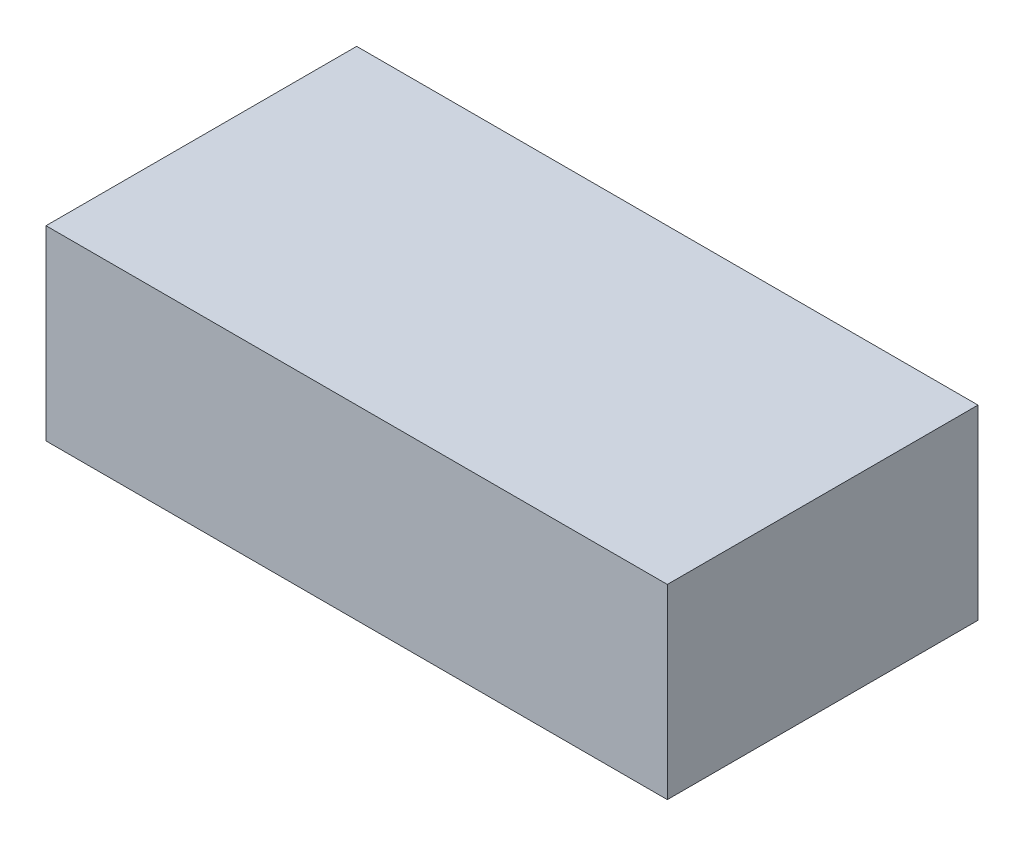
from build123d import *

# Parameters (mm, degrees)
SKETCH1_W           = 20
SKETCH1_H           = 10
BOSS_EXTRUDE1_DEPTH = 6


with BuildPart() as part:
    # Sketch1 → Boss-Extrude1 (new body)
    with BuildSketch(Plane(origin=(0, 0, 0), x_dir=(1, 0, 0), z_dir=(0, 1, 0))):
        Rectangle(SKETCH1_W, SKETCH1_H)
    extrude(amount=BOSS_EXTRUDE1_DEPTH)


solid = part.part
